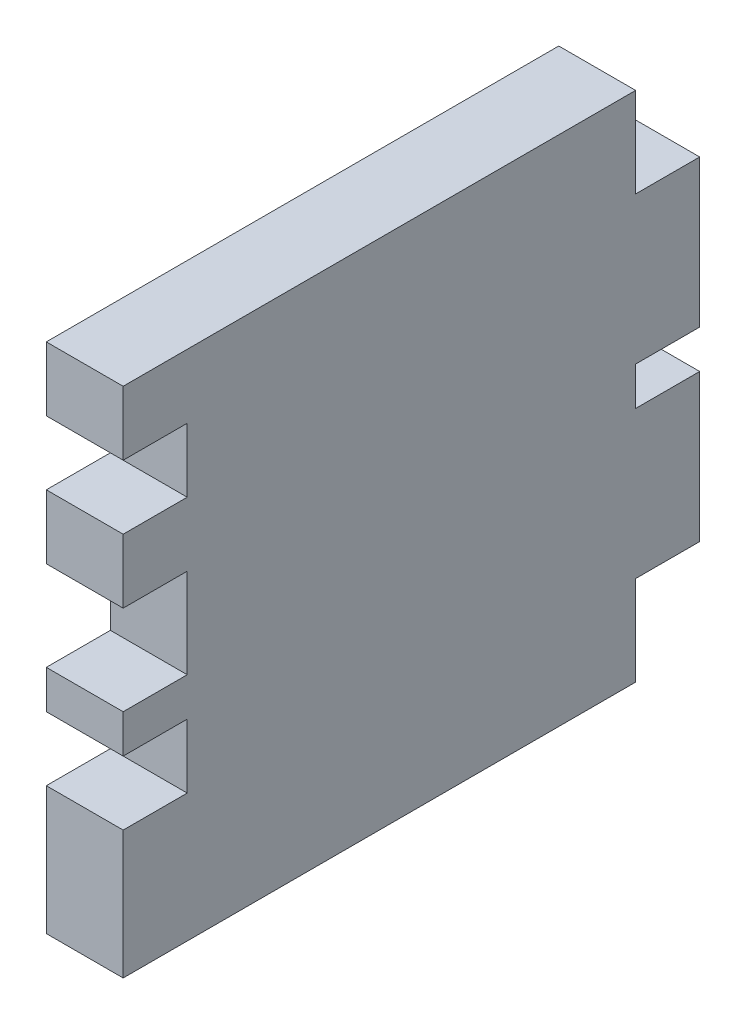
from build123d import *

# Parameters (mm, degrees)
SKETCH1_W           = 45
SKETCH1_H           = 40
BOSS_EXTRUDE1_DEPTH = 6
SKETCH2_W           = 5
SKETCH2_H           = 5
SKETCH2_H_2         = 7
CUT_EXTRUDE1_DEPTH  = 6
SKETCH3_W           = 5
SKETCH3_H           = 7
SKETCH3_H_2         = 3
CUT_EXTRUDE2_DEPTH  = 6


with BuildPart() as part:
    # Sketch1 → Boss-Extrude1 (new body)
    with BuildSketch(Plane(origin=(0, 0, 0), x_dir=(0, 0, -1), z_dir=(1, 0, 0))):
        with Locations((0.079787234, -3.244680851)):
            Rectangle(SKETCH1_W, SKETCH1_H)
    extrude(amount=BOSS_EXTRUDE1_DEPTH)

    # Sketch2 → Cut-Extrude1 (cut)
    with BuildSketch(Plane(origin=(6, 0, 0), x_dir=(0, 0, -1), z_dir=(1, 0, 0))):
        with Locations((-19.920212766, 9.255319149)):
            Rectangle(SKETCH2_W, SKETCH2_H)
        with Locations((-19.920212766, -1.744680851)):
            Rectangle(SKETCH2_W, SKETCH2_H_2)
        with Locations((-19.920212766, -10.744680851)):
            Rectangle(SKETCH2_W, SKETCH2_H)
    extrude(amount=-CUT_EXTRUDE1_DEPTH, mode=Mode.SUBTRACT)

    # Sketch3 → Cut-Extrude2 (cut)
    with BuildSketch(Plane(origin=(6, 0, 0), x_dir=(0, 0, -1), z_dir=(1, 0, 0))):
        with Locations((20.079787234, 13.255319149)):
            Rectangle(SKETCH3_W, SKETCH3_H)
        with Locations((20.079787234, -3.244680851)):
            Rectangle(SKETCH3_W, SKETCH3_H_2)
        with Locations((20.079787234, -19.744680851)):
            Rectangle(SKETCH3_W, SKETCH3_H)
    extrude(amount=-CUT_EXTRUDE2_DEPTH, mode=Mode.SUBTRACT)


solid = part.part
